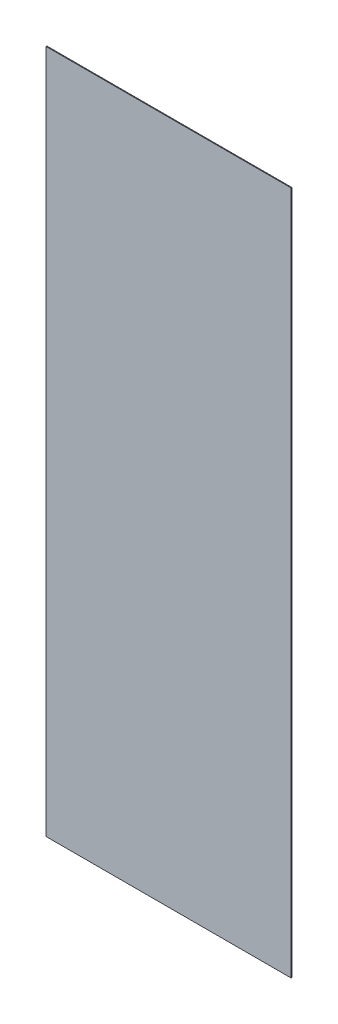
from build123d import *

# Parameters (mm, degrees)
TOPPING_ARKA_DUVAR_KAPAK_SACI_1_START = -720
SKETCH1_W                             = 615
SKETCH1_H                             = 1717.5
TOPPING_ARKA_DUVAR_KAPAK_SACI_1_DEPTH = 2


with BuildPart() as part:
    # Sketch1 → TOPPING_arka_duvar_kapak_saci_1 (new body)
    with BuildSketch(Plane.XY.offset(TOPPING_ARKA_DUVAR_KAPAK_SACI_1_START)):
        with Locations((350, 1101.25)):
            Rectangle(SKETCH1_W, SKETCH1_H)
    extrude(amount=-TOPPING_ARKA_DUVAR_KAPAK_SACI_1_DEPTH)


solid = part.part
